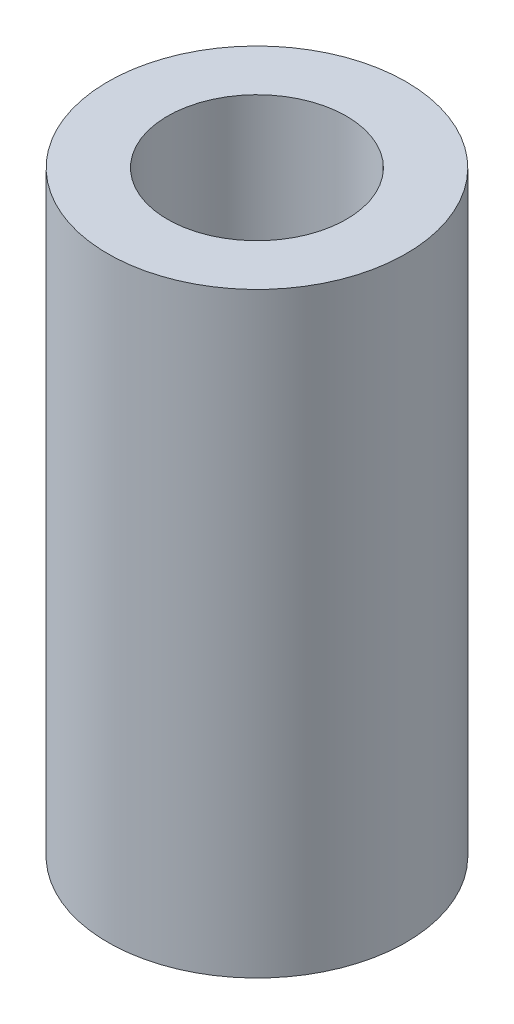
from build123d import *

# Parameters (mm, degrees)
CROQUIS1_W = 1
CROQUIS1_H = 10


with BuildPart() as part:
    # Croquis1 → Revolución1 (revolve)
    with BuildSketch(Plane.XY, mode=Mode.PRIVATE) as revoluci_n1_sk:
        with Locations((-2, 5)):
            Rectangle(CROQUIS1_W, CROQUIS1_H)
    revolve(revoluci_n1_sk.sketch.rotate(Axis((0, 0, 0), (0, 1, 0)), 270), axis=Axis((0, 0, 0), (0, 1, 0)))


solid = part.part
